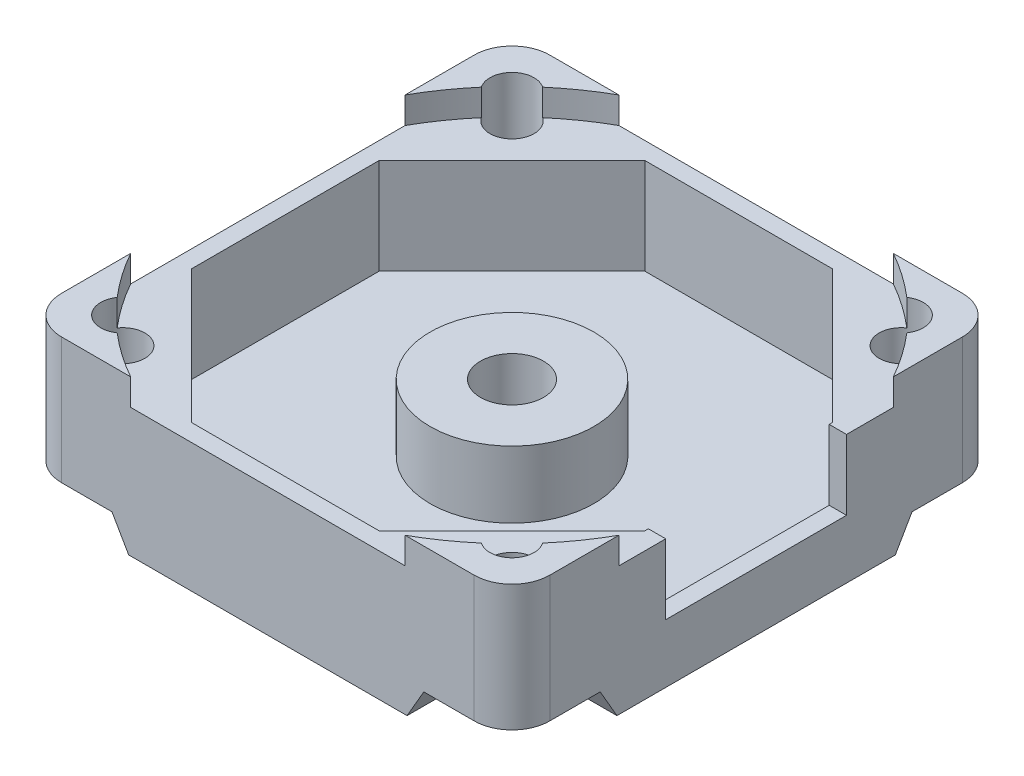
from build123d import *

# Parameters (mm, degrees)
SKETCH1_R           = 2.5
SKETCH1_R_2         = 1.75
BOSS_EXTRUDE1_DEPTH = 2.61
SKETCH2_R           = 1.75
BOSS_EXTRUDE2_DEPTH = 7.71
CUT_EXTRUDE1_START  = -2.3
CUT_EXTRUDE1_DEPTH  = 32.579406586
CUT_EXTRUDE1_TAPER  = -30
CIRPATTERN1_COUNT   = 4
CUT_EXTRUDE2_REACH  = 46.536
SKETCH6_W           = 14.35
SKETCH6_H           = 15.668786702
SKETCH7_R           = 1.75
BOSS_EXTRUDE3_DEPTH = 2
SKETCH9_W           = 16.172360651
SKETCH9_H           = 2.1
SKETCH10_R          = 6.5
SKETCH10_R_2        = 2.5
BOSS_EXTRUDE4_DEPTH = 5.3


with BuildPart() as part:
    # Sketch1 → Boss-Extrude1 (new body)
    with BuildSketch(Plane(origin=(0, 0, 0), x_dir=(1, 0, 0), z_dir=(0, 1, 0))):
        with BuildLine():
            Line((-16.375, -19.375), (16.375, -19.375))
            ThreePointArc((16.375, -19.375), (18.496320344, -18.496320344), (19.375, -16.375))
            Line((19.375, -16.375), (19.375, 16.375))
            ThreePointArc((19.375, 16.375), (18.496320344, 18.496320344), (16.375, 19.375))
            Line((16.375, 19.375), (-16.375, 19.375))
            ThreePointArc((-16.375, 19.375), (-18.496320344, 18.496320344), (-19.375, 16.375))
            Line((-19.375, 16.375), (-19.375, -16.375))
            ThreePointArc((-19.375, -16.375), (-18.496320344, -18.496320344), (-16.375, -19.375))
        make_face()
        with Locations(Location((0, 0, 0), (0, 0, 270))):
            Circle(SKETCH1_R, mode=Mode.SUBTRACT)
        with Locations(Location((-15.444979868, 15.444979868, 0), (0, 0, 270))):
            Circle(SKETCH1_R_2, mode=Mode.SUBTRACT)
        with Locations(Location((15.444979868, 15.444979868, 0), (0, 0, 270))):
            Circle(SKETCH1_R_2, mode=Mode.SUBTRACT)
        with Locations(Location((15.444979868, -15.444979868, 0), (0, 0, 270))):
            Circle(SKETCH1_R_2, mode=Mode.SUBTRACT)
        with Locations(Location((-15.444979868, -15.444979868, 0), (0, 0, 270))):
            Circle(SKETCH1_R_2, mode=Mode.SUBTRACT)
    extrude(amount=BOSS_EXTRUDE1_DEPTH)

    # Sketch2 → Boss-Extrude2 (add)
    with BuildSketch(Plane(origin=(0, 2.61, 0), x_dir=(1, 0, 0), z_dir=(0, 1, 0))):
        with BuildLine():
            Line((19.375, -16.375), (19.375, 16.375))
            ThreePointArc((19.375, 16.375), (18.496320344, 18.496320344), (16.375, 19.375))
            Line((16.375, 19.375), (-16.375, 19.375))
            ThreePointArc((-16.375, 19.375), (-18.496320344, 18.496320344), (-19.375, 16.375))
            Line((-19.375, 16.375), (-19.375, -16.375))
            ThreePointArc((-19.375, -16.375), (-18.496320344, -18.496320344), (-16.375, -19.375))
            Line((-16.375, -19.375), (16.375, -19.375))
            ThreePointArc((16.375, -19.375), (18.496320344, -18.496320344), (19.375, -16.375))
        make_face()
        with Locations(Location((-15.444979868, 15.444979868, 0), (0, 0, 270))):
            Circle(SKETCH2_R, mode=Mode.SUBTRACT)
        with Locations(Location((15.444979868, 15.444979868, 0), (0, 0, 270))):
            Circle(SKETCH2_R, mode=Mode.SUBTRACT)
        with Locations(Location((15.444979868, -15.444979868, 0), (0, 0, 270))):
            Circle(SKETCH2_R, mode=Mode.SUBTRACT)
        with Locations(Location((-15.444979868, -15.444979868, 0), (0, 0, 270))):
            Circle(SKETCH2_R, mode=Mode.SUBTRACT)
        Polygon((-7.455844123, 18), (7.455844123, 18), (18, 7.455844123), (18, -7.455844123), (7.455844123, -18), (-7.455844123, -18), (-18, -7.455844123), (-18, 7.455844123), align=None, mode=Mode.SUBTRACT)
    extrude(amount=BOSS_EXTRUDE2_DEPTH)

    # Sketch4 → Cut-Extrude1 (cut, through all)
    with BuildSketch(Plane.XZ.offset(CUT_EXTRUDE1_START)):
        with BuildLine():
            Line((12.375, 19.375), (12.375, 15.444979868))
            ThreePointArc((12.375, 15.444979868), (13.274176285, 13.274176285), (15.444979868, 12.375))
            Line((15.444979868, 12.375), (19.375, 12.375))
            Line((19.375, 12.375), (19.375, 16.375))
            ThreePointArc((19.375, 16.375), (18.496320344, 18.496320344), (16.375, 19.375))
            Line((16.375, 19.375), (12.375, 19.375))
        make_face()
    cut_extrude1 = extrude(amount=CUT_EXTRUDE1_DEPTH, taper=CUT_EXTRUDE1_TAPER, mode=Mode.SUBTRACT)

    # CirPattern1: Cut-Extrude1 ×4 about axis
    cirpattern1_axis = Axis((0, 0, 0), (0, 1, 0))
    for i in range(1, CIRPATTERN1_COUNT):
        add(cut_extrude1.rotate(cirpattern1_axis, i * 360 / CIRPATTERN1_COUNT), mode=Mode.SUBTRACT)

    # Sketch6 → Cut-Extrude2 (cut, up to next)
    with BuildSketch(Plane(origin=(19.375, 0, 0), x_dir=(0, 0, -1), z_dir=(1, 0, 0)), mode=Mode.PRIVATE) as cut_extrude2_sk1:
        with Locations((0, 12.494393351)):
            Rectangle(SKETCH6_W, SKETCH6_H)
    cut_extrude2_tool1 = extrude(cut_extrude2_sk1.sketch, amount=-CUT_EXTRUDE2_REACH, mode=Mode.PRIVATE) & part.part
    add(cut_extrude2_tool1.solids().sort_by_distance((19.375, 12.494393, 0))[0], mode=Mode.SUBTRACT)

    # Sketch7 → Boss-Extrude3 (add)
    with BuildSketch(Plane(origin=(0, 10.32, 0), x_dir=(1, 0, 0), z_dir=(0, 1, 0))):
        with BuildLine():
            Line((19.375, -7.175), (18, -7.175))
            Line((18, -7.175), (18, -7.455844123))
            Line((18, -7.455844123), (7.455844123, -18))
            Line((7.455844123, -18), (-7.455844123, -18))
            Line((-7.455844123, -18), (-18, -7.455844123))
            Line((-18, -7.455844123), (-18, 7.455844123))
            Line((-18, 7.455844123), (-7.455844123, 18))
            Line((-7.455844123, 18), (7.455844123, 18))
            Line((7.455844123, 18), (18, 7.455844123))
            Line((18, 7.455844123), (18, 7.175))
            Line((18, 7.175), (19.375, 7.175))
            Line((19.375, 7.175), (19.375, 16.375))
            ThreePointArc((19.375, 16.375), (18.496320344, 18.496320344), (16.375, 19.375))
            Line((16.375, 19.375), (-16.375, 19.375))
            ThreePointArc((-16.375, 19.375), (-18.496320344, 18.496320344), (-19.375, 16.375))
            Line((-19.375, 16.375), (-19.375, -16.375))
            ThreePointArc((-19.375, -16.375), (-18.496320344, -18.496320344), (-16.375, -19.375))
            Line((-16.375, -19.375), (16.375, -19.375))
            ThreePointArc((16.375, -19.375), (18.496320344, -18.496320344), (19.375, -16.375))
            Line((19.375, -16.375), (19.375, -7.175))
        make_face()
        with Locations(Location((-15.444979868, -15.444979868, 0), (0, 0, 90))):
            Circle(SKETCH7_R, mode=Mode.SUBTRACT)
        with Locations(Location((15.444979868, -15.444979868, 0), (0, 0, 90))):
            Circle(SKETCH7_R, mode=Mode.SUBTRACT)
        with Locations(Location((15.444979868, 15.444979868, 0), (0, 0, 90))):
            Circle(SKETCH7_R, mode=Mode.SUBTRACT)
        with Locations(Location((-15.444979868, 15.444979868, 0), (0, 0, 90))):
            Circle(SKETCH7_R, mode=Mode.SUBTRACT)
    extrude(amount=BOSS_EXTRUDE3_DEPTH)

    # Sketch9 → Cut-Revolve1 (revolve, cut)
    with BuildSketch(Plane(origin=(0, 0, 0), x_dir=(0.7071067811865475, 0, 0.7071067811865477), z_dir=(-0.7071067811865477, 0, 0.7071067811865475))):
        with Locations((14.138819675, 11.27)):
            Rectangle(SKETCH9_W, SKETCH9_H)
    revolve(axis=Axis((0, 0, 0), (0, 1, 0)), mode=Mode.SUBTRACT)

    # Sketch10 → Boss-Extrude4 (add)
    with BuildSketch(Plane(origin=(0, 2.61, 0), x_dir=(1, 0, 0), z_dir=(0, 1, 0))):
        with Locations(Location((0, 0, 0), (0, 0, 270))):
            Circle(SKETCH10_R)
        with Locations(Location((0, 0, 0), (0, 0, 270))):
            Circle(SKETCH10_R_2, mode=Mode.SUBTRACT)
    extrude(amount=BOSS_EXTRUDE4_DEPTH)


solid = part.part
